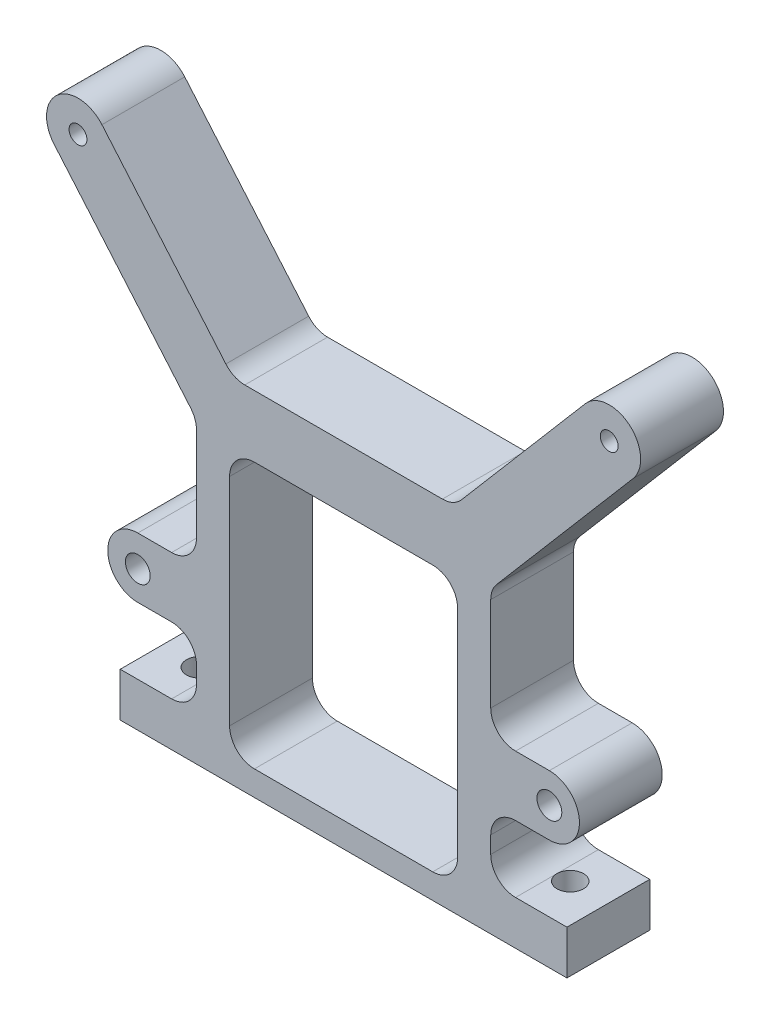
from build123d import *

# Parameters (mm, degrees)
SKETCH1_R      = 1.3716
SKETCH1_R_2    = 1.905
EXTRUDE1_DEPTH = 12.7
SKETCH2_R      = 2.032
EXTRUDE2_DEPTH = 9.652


with BuildPart() as part:
    # Sketch1 → Extrude1 (new body)
    with BuildSketch(Plane.XY):
        with BuildLine():
            Line((-44.40070708, 58.959918893), (-23.474438879, 34.429033799))
            ThreePointArc((-23.474438879, 34.429033799), (-22.79815009, 33.273999736), (-22.563049012, 31.956351187))
            Line((-22.563049012, 31.956351187), (-22.563049012, 17.553595327))
            ThreePointArc((-22.563049012, 17.553595327), (-23.678972175, 14.85951849), (-26.373049012, 13.743595327))
            Line((-26.373049012, 13.743595327), (-31.554570289, 13.743595327))
            ThreePointArc((-31.554570289, 13.743595327), (-36.166042792, 9.132122824), (-31.554570289, 4.520650321))
            Line((-31.554570289, 4.520650321), (-26.373049012, 4.520650321))
            ThreePointArc((-26.373049012, 4.520650321), (-23.678972175, 3.404727157), (-22.563049012, 0.710650321))
            Line((-22.563049012, 0.710650321), (-22.563049012, -1.885593273))
            ThreePointArc((-22.563049012, -1.885593273), (-23.678972175, -4.579670109), (-26.373049012, -5.695593273))
            Line((-26.373049012, -5.695593273), (-34.251425283, -5.695593273))
            Line((-34.251425283, -5.695593273), (-34.251425283, -12.452071481))
            Line((-34.251425283, -12.452071481), (34.251425283, -12.452071481))
            Line((34.251425283, -12.452071481), (34.251425283, -5.695593273))
            Line((34.251425283, -5.695593273), (26.373049012, -5.695593273))
            ThreePointArc((26.373049012, -5.695593273), (23.678972175, -4.579670109), (22.563049012, -1.885593273))
            Line((22.563049012, -1.885593273), (22.563049012, 0.710650321))
            ThreePointArc((22.563049012, 0.710650321), (23.678972175, 3.404727157), (26.373049012, 4.520650321))
            Line((26.373049012, 4.520650321), (31.554570289, 4.520650321))
            ThreePointArc((31.554570289, 4.520650321), (36.166042792, 9.132122824), (31.554570289, 13.743595327))
            Line((31.554570289, 13.743595327), (26.373049012, 13.743595327))
            ThreePointArc((26.373049012, 13.743595327), (23.678972175, 14.85951849), (22.563049012, 17.553595327))
            Line((22.563049012, 17.553595327), (22.563049012, 31.956351187))
            ThreePointArc((22.563049012, 31.956351187), (22.79815009, 33.273999736), (23.474438879, 34.429033799))
            Line((23.474438879, 34.429033799), (44.40070708, 58.959918893))
            ThreePointArc((44.40070708, 58.959918893), (43.861334165, 65.761850412), (37.059402646, 65.222477498))
            Line((37.059402646, 65.222477498), (18.05525325, 42.944802345))
            ThreePointArc((18.05525325, 42.944802345), (16.752760164, 41.957931463), (15.156643118, 41.607484957))
            Line((15.156643118, 41.607484957), (-15.156643118, 41.607484957))
            ThreePointArc((-15.156643118, 41.607484957), (-16.752760164, 41.957931463), (-18.05525325, 42.944802345))
            Line((-18.05525325, 42.944802345), (-37.059402646, 65.222477498))
            ThreePointArc((-37.059402646, 65.222477498), (-43.861334165, 65.761850412), (-44.40070708, 58.959918893))
        make_face()
        with Locations((-40.730054863, 62.091198195)):
            Circle(SKETCH1_R, mode=Mode.SUBTRACT)
        with Locations(Location((31.554570289, 9.132122824, 0), (0, 0, 180))):
            Circle(SKETCH1_R_2, mode=Mode.SUBTRACT)
        with Locations(Location((40.730054863, 62.091198195, 0), (0, 0, 180))):
            Circle(SKETCH1_R, mode=Mode.SUBTRACT)
        with Locations((-31.554570289, 8.979309022)):
            Circle(SKETCH1_R_2, mode=Mode.SUBTRACT)
        with BuildLine():
            Line((-13.673049012, 32.09814334), (13.673049012, 32.09814334))
            ThreePointArc((13.673049012, 32.09814334), (16.367125848, 30.982220177), (17.483049012, 28.28814334))
            Line((17.483049012, 28.28814334), (17.483049012, -4.832071481))
            ThreePointArc((17.483049012, -4.832071481), (16.367125848, -7.526148317), (13.673049012, -8.642071481))
            Line((13.673049012, -8.642071481), (-13.673049012, -8.642071481))
            ThreePointArc((-13.673049012, -8.642071481), (-16.367125848, -7.526148317), (-17.483049012, -4.832071481))
            Line((-17.483049012, -4.832071481), (-17.483049012, 28.28814334))
            ThreePointArc((-17.483049012, 28.28814334), (-16.367125848, 30.982220177), (-13.673049012, 32.09814334))
        make_face(mode=Mode.SUBTRACT)
    extrude(amount=EXTRUDE1_DEPTH)

    # Sketch2 → Extrude2 (cut)
    with BuildSketch(Plane.XZ.offset(12.452071481)):
        with Locations(Location((28.407237147, 6.35, 0), (0, 0, 270))):
            Circle(SKETCH2_R)
        with Locations(Location((-28.407237147, 6.35, 0), (0, 0, 270))):
            Circle(SKETCH2_R)
    extrude(amount=-EXTRUDE2_DEPTH, mode=Mode.SUBTRACT)


solid = part.part
